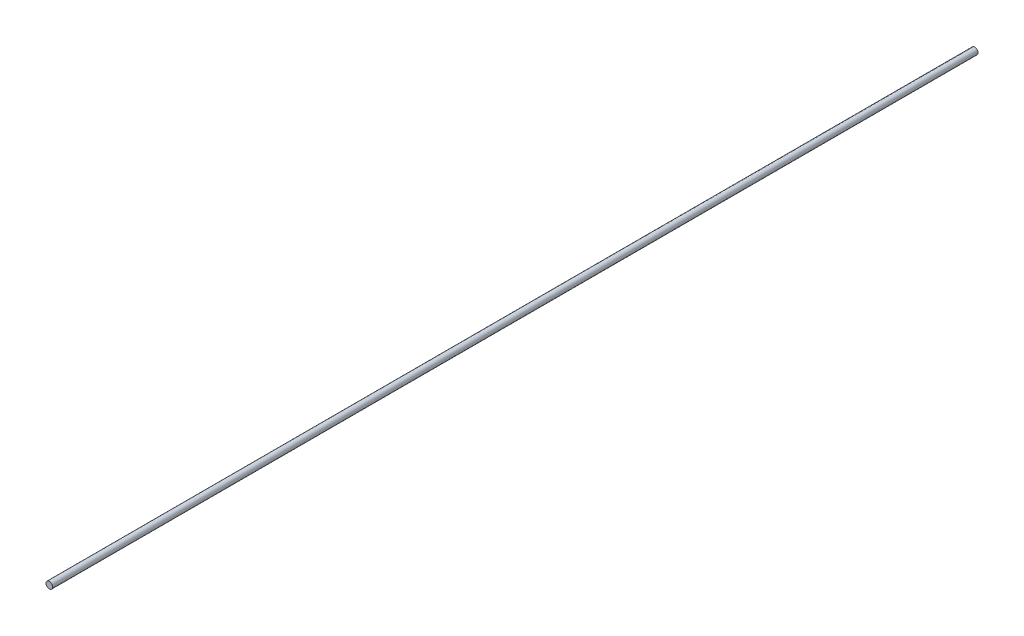
from build123d import *

# Parameters (mm, degrees)
SKETCH1_R           = 6
BOSS_EXTRUDE1_DEPTH = 1700


with BuildPart() as part:
    # Sketch1 → Boss-Extrude1 (new body)
    with BuildSketch(Plane.XY):
        with Locations((-13.132075472, 3.452830189)):
            Circle(SKETCH1_R)
    extrude(amount=BOSS_EXTRUDE1_DEPTH)


solid = part.part
